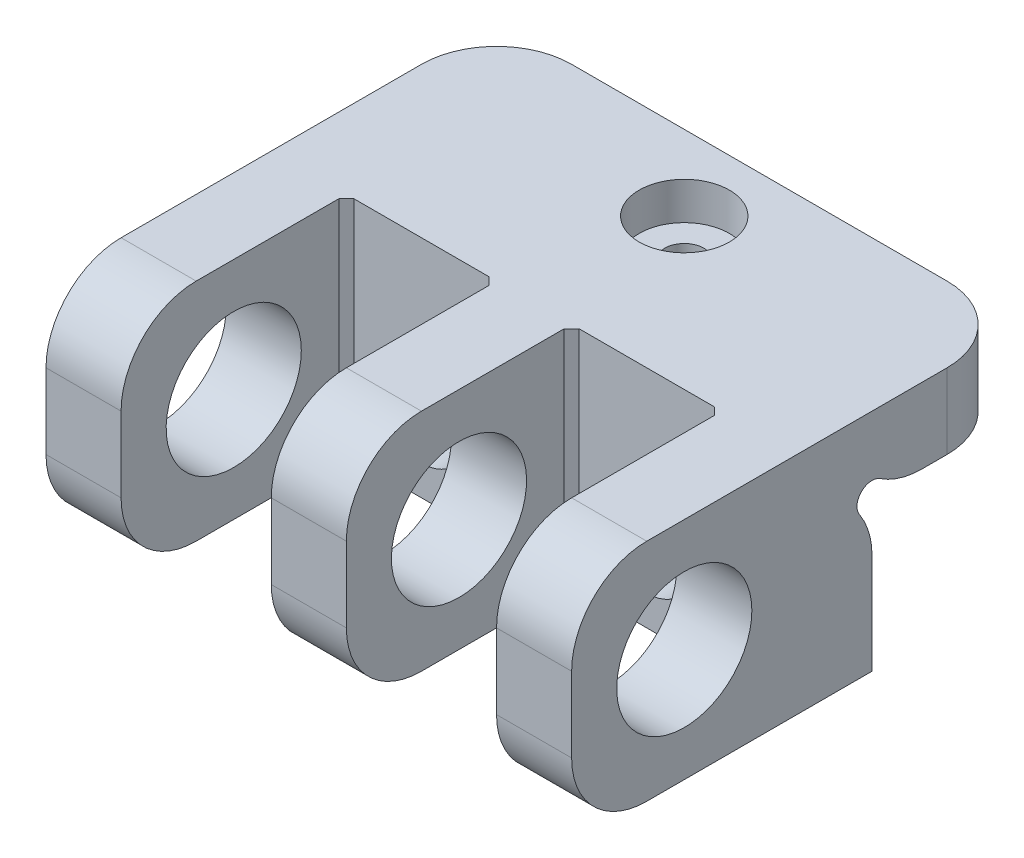
from build123d import *

# Parameters (mm, degrees)
SZKIC1_W                    = 70
SZKIC1_H                    = 30
DODANIE_WYCI_GNI_CIE1_DEPTH = 10
SZKIC2_W                    = 70
SZKIC2_H                    = 10
DODANIE_WYCI_GNI_CIE2_DEPTH = 20
SZKIC3_R                    = 2
WYTNIJ_WYCI_GNI_CIE1_DEPTH  = 75.330343737
ZAOKR_GLENIE1_R             = 10
SZKIC4_W                    = 10
SZKIC4_H                    = 30
DODANIE_WYCI_GNI_CIE3_DEPTH = 30
SZKIC5_R                    = 2.6
WYTNIJ_WYCI_GNI_CIE2_DEPTH  = 49.476798574
SZKIC6_R                    = 6
WYTNIJ_WYCI_GNI_CIE3_DEPTH  = 5
SZKIC7_R                    = 2.6
WYTNIJ_WYCI_GNI_CIE4_DEPTH  = 62.032778079
SZKIC8_R                    = 6
WYTNIJ_WYCI_GNI_CIE5_DEPTH  = 5
ZAOKR_GLENIE2_R             = 10
SZKIC9_R                    = 9
WYTNIJ_WYCI_GNI_CIE6_DEPTH  = 83.006097334
SFAZOWANIE1_SIZE            = 1


with BuildPart() as part:
    # Szkic1 → Dodanie-wyciągnięcie1 (new body)
    with BuildSketch(Plane.XY):
        Rectangle(SZKIC1_W, SZKIC1_H)
    extrude(amount=DODANIE_WYCI_GNI_CIE1_DEPTH)

    # Szkic2 → Dodanie-wyciągnięcie2 (add)
    with BuildSketch(Plane(origin=(0, 0, 0), x_dir=(-1, 0, 0), z_dir=(0, 0, -1))):
        with Locations((0, 10)):
            Rectangle(SZKIC2_W, SZKIC2_H)
    extrude(amount=DODANIE_WYCI_GNI_CIE2_DEPTH)

    # Szkic3 → Wytnij-wyciągnięcie1 (cut, through all)
    with BuildSketch(Plane(origin=(35, 0, 0), x_dir=(0, 0, -1), z_dir=(1, 0, 0))):
        with Locations((0, 5)):
            Circle(SZKIC3_R)
    extrude(amount=-WYTNIJ_WYCI_GNI_CIE1_DEPTH, mode=Mode.SUBTRACT)

    # Zaokrąglenie1
    zaokr_glenie1_edges = [part.edges().sort_by_distance(p)[0] for p in [
        (0, 5, -2),
        (0, 3, 0),
    ]]
    fillet(zaokr_glenie1_edges, radius=ZAOKR_GLENIE1_R)

    # Szkic4 → Dodanie-wyciągnięcie3 (add)
    with BuildSketch(Plane.XY.offset(10)):
        with Locations((-30, 0)):
            Rectangle(SZKIC4_W, SZKIC4_H)
        Rectangle(SZKIC4_W, SZKIC4_H)
        with Locations((30, 0)):
            Rectangle(SZKIC4_W, SZKIC4_H)
    extrude(amount=DODANIE_WYCI_GNI_CIE3_DEPTH)

    # Szkic5 → Wytnij-wyciągnięcie2 (cut, through all)
    with BuildSketch(Plane.XY.offset(10)):
        with Locations((-15, -5)):
            Circle(SZKIC5_R)
    wytnij_wyci_gni_cie2 = extrude(amount=-WYTNIJ_WYCI_GNI_CIE2_DEPTH, mode=Mode.SUBTRACT)

    # Szkic6 → Wytnij-wyciągnięcie3 (cut)
    with BuildSketch(Plane.XY.offset(10)):
        with Locations((-15, -5)):
            Circle(SZKIC6_R)
    wytnij_wyci_gni_cie3 = extrude(amount=-WYTNIJ_WYCI_GNI_CIE3_DEPTH, mode=Mode.SUBTRACT)

    # Lustro1: Wytnij-wyciągnięcie2, Wytnij-wyciągnięcie3 across plane
    add(wytnij_wyci_gni_cie2.mirror(Plane.ZY), mode=Mode.SUBTRACT)
    add(wytnij_wyci_gni_cie3.mirror(Plane.ZY), mode=Mode.SUBTRACT)

    # Szkic7 → Wytnij-wyciągnięcie4 (cut, through all)
    with BuildSketch(Plane(origin=(0, 15, 0), x_dir=(1, 0, 0), z_dir=(0, 1, 0))):
        with Locations(Location((0, 10, 0), (0, 0, 270))):
            Circle(SZKIC7_R)
    extrude(amount=-WYTNIJ_WYCI_GNI_CIE4_DEPTH, mode=Mode.SUBTRACT)

    # Szkic8 → Wytnij-wyciągnięcie5 (cut)
    with BuildSketch(Plane(origin=(0, 15, 0), x_dir=(1, 0, 0), z_dir=(0, 1, 0))):
        with Locations(Location((0, 10, 0), (0, 0, 270))):
            Circle(SZKIC8_R)
    extrude(amount=-WYTNIJ_WYCI_GNI_CIE5_DEPTH, mode=Mode.SUBTRACT)

    # Zaokrąglenie2
    zaokr_glenie2_edges = [part.edges().sort_by_distance(p)[0] for p in [
        (35, 10, -20),
        (-35, 10, -20),
        (-30, -15, 40),
        (-30, 15, 40),
        (0, -15, 40),
        (0, 15, 40),
        (30, 15, 40),
        (30, -15, 40),
    ]]
    fillet(zaokr_glenie2_edges, radius=ZAOKR_GLENIE2_R)

    # Szkic9 → Wytnij-wyciągnięcie6 (cut, through all)
    with BuildSketch(Plane(origin=(35, 0, 0), x_dir=(0, 0, -1), z_dir=(1, 0, 0))):
        with Locations((-25, 0)):
            Circle(SZKIC9_R)
    extrude(amount=-WYTNIJ_WYCI_GNI_CIE6_DEPTH, mode=Mode.SUBTRACT)

    # Sfazowanie1
    sfazowanie1_edges = [part.edges().sort_by_distance(p)[0] for p in [
        (-25, 0, 10),
        (-5, 0, 10),
        (5, 0, 10),
        (25, 0, 10),
    ]]
    chamfer(sfazowanie1_edges, length=SFAZOWANIE1_SIZE)


solid = part.part
